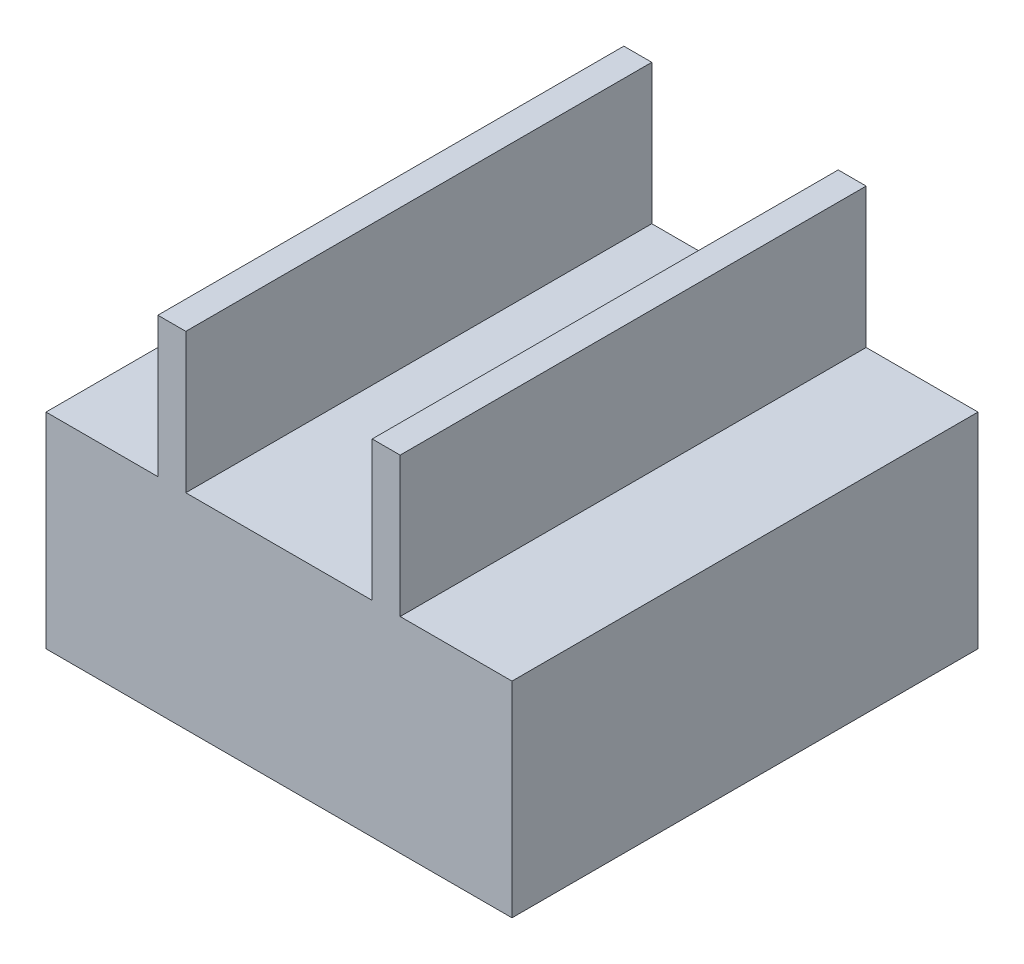
from build123d import *

# Parameters (mm, degrees)
SKETCH_1_W                  = 50
SKETCH_1_H                  = 50
EXTRUDE_1_DEPTH             = 2
SKETCH_2_W                  = 3
SKETCH_2_H                  = 50
EXTRUDE_2_DEPTH             = 15
EXTRUDE_3_DEPTH             = 25
EXTRUDE_3_DEPTH_BACK        = 25
EXTRUDE_4_REACH             = 50.587
EXTRUDE_4_DIRECTION_2_REACH = 50.587
SKETCH_7_W                  = 93.751420651
SKETCH_7_H                  = 87.806812737
SKETCH_7_W_2                = 50
SKETCH_7_H_2                = 50
CUT_EXTRUDE_1_DEPTH         = 25
SKETCH_8_W                  = 44
SKETCH_8_H                  = 44
CUT_EXTRUDE_2_DEPTH         = 18
CHAMFER_1_SIZE              = 2


with BuildPart() as part:
    # 草图1 → 凸台-拉伸1 (new body)
    with BuildSketch(Plane(origin=(0, 0, 0), x_dir=(1, 0, 0), z_dir=(0, 1, 0))):
        Rectangle(SKETCH_1_W, SKETCH_1_H)
    extrude(amount=EXTRUDE_1_DEPTH)

    # 草图2 → 凸台-拉伸2 (add)
    with BuildSketch(Plane(origin=(0, 2, 0), x_dir=(1, 0, 0), z_dir=(0, 1, 0))):
        with Locations((-11.5, 0)):
            Rectangle(SKETCH_2_W, SKETCH_2_H)
        with Locations((11.5, 0)):
            Rectangle(SKETCH_2_W, SKETCH_2_H)
    extrude(amount=EXTRUDE_2_DEPTH)

    # 草图5 → 凸台-拉伸3 (add, two sides: drawn at the far end of the back side and taken through both)
    with BuildSketch(Plane(origin=(0, 0, 0), x_dir=(0, 0, -1), z_dir=(1, 0, 0)).offset(-EXTRUDE_3_DEPTH_BACK)):
        Polygon((25, 0), (0, 0), (0, -20), (36.547005384, -20), align=None)
        Polygon((0, 0), (-25, 0), (-36.547005384, -20), (0, -20), align=None)
    extrude(amount=EXTRUDE_3_DEPTH + EXTRUDE_3_DEPTH_BACK)

    # 凸台-拉伸4: up to this plane
    extrude_4_end = Plane(origin=(-25, 10.825317547, 18.75), z_dir=(0, 0.4999999999999978, 0.86602540378444))
    # 草图6 → 凸台-拉伸4 (add, up to the surface)
    with BuildSketch(Plane.XY, mode=Mode.PRIVATE) as extrude_4_sk1:
        Polygon((-25, 0), (-36.547005384, -20), (-25, -20), align=None)
    extrude_4_tool1 = split(extrude(extrude_4_sk1.sketch, amount=EXTRUDE_4_REACH, mode=Mode.PRIVATE), bisect_by=extrude_4_end, keep=Keep.BOTH, mode=Mode.PRIVATE)
    extrude_4 = extrude_4_tool1.solids().sort_by_distance((-28.849002, -13.333333, 0))[0]
    add(extrude_4)

    # 凸台-拉伸4 direction 2: up to this plane
    extrude_4_direction_2_end = Plane(origin=(-25, 10.825317547, -18.75), z_dir=(0, -0.4999999999999978, 0.86602540378444))
    # 草图6 → 凸台-拉伸4 direction 2 (add, up to the surface)
    with BuildSketch(Plane.XY, mode=Mode.PRIVATE) as extrude_4_direction_2_sk1:
        Polygon((-25, 0), (-36.547005384, -20), (-25, -20), align=None)
    extrude_4_direction_2_tool1 = split(extrude(extrude_4_direction_2_sk1.sketch, amount=-EXTRUDE_4_DIRECTION_2_REACH, mode=Mode.PRIVATE), bisect_by=extrude_4_direction_2_end, keep=Keep.BOTH, mode=Mode.PRIVATE)
    extrude_4_direction_2 = extrude_4_direction_2_tool1.solids().sort_by_distance((-28.849002, -13.333333, 0))[0]
    add(extrude_4_direction_2)
    extrude_4 = extrude_4 + extrude_4_direction_2  # both directions under the feature's name, for the pattern or mirror that repeats it

    # 镜向1: 凸台-拉伸4 across plane
    add(extrude_4.mirror(Plane(origin=(0, 0, 0), x_dir=(0, 0, 1), z_dir=(1, 0, 0))))

    # 草图7 → 切除-拉伸1 (cut)
    with BuildSketch(Plane(origin=(0, 2, 0), x_dir=(1, 0, 0), z_dir=(0, 1, 0))):
        with Locations((6.640722021, -2.029388647)):
            Rectangle(SKETCH_7_W, SKETCH_7_H)
        Rectangle(SKETCH_7_W_2, SKETCH_7_H_2, mode=Mode.SUBTRACT)
    extrude(amount=-CUT_EXTRUDE_1_DEPTH, mode=Mode.SUBTRACT)

    # 草图8 → 切除-拉伸2 (cut)
    with BuildSketch(Plane.XZ.offset(20)):
        Rectangle(SKETCH_8_W, SKETCH_8_H)
    extrude(amount=-CUT_EXTRUDE_2_DEPTH, mode=Mode.SUBTRACT)

    # 倒角1
    chamfer_1_edges = [part.edges().sort_by_distance(p)[0] for p in [
        (-22, -20, 0),
        (0, -20, -22),
        (22, -20, 0),
        (0, -20, 22),
    ]]
    chamfer(chamfer_1_edges, length=CHAMFER_1_SIZE)


solid = part.part
